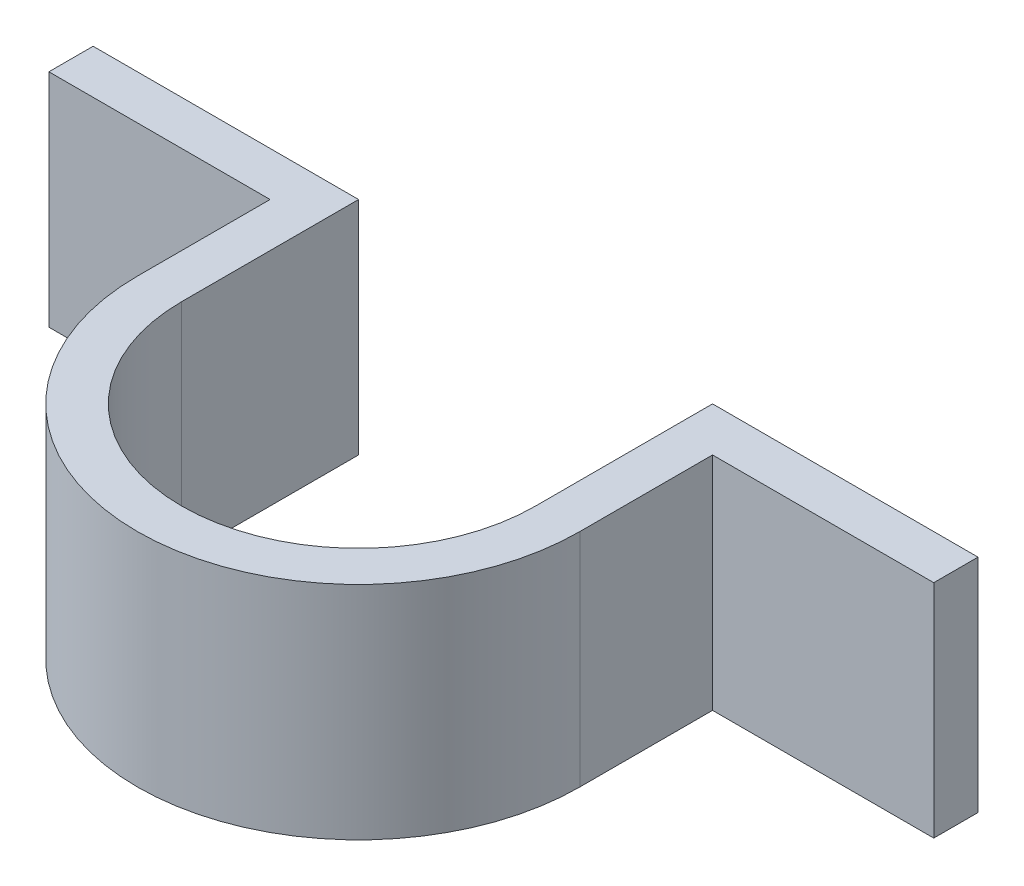
from build123d import *

# Parameters (mm, degrees)
BOSS_EXTRUDE2_DEPTH      = 2.5
BOSS_EXTRUDE2_DEPTH_BACK = 2.5


with BuildPart() as part:
    # Sketch1 → Boss-Extrude2 (new, two sides: drawn at the far end of the back side and taken through both)
    with BuildSketch(Plane(origin=(0, 0, 0), x_dir=(1, 0, 0), z_dir=(0, 1, 0)).offset(-BOSS_EXTRUDE2_DEPTH_BACK)):
        with BuildLine():
            Line((-4, 0), (-4, 4))
            Line((-4, 4), (-10, 4))
            Line((-10, 4), (-10, 3))
            Line((-10, 3), (-5, 3))
            Line((-5, 3), (-5, 0))
            ThreePointArc((-5, 0), (0, -5), (5, 0))
            Line((5, 0), (5, 3))
            Line((5, 3), (10, 3))
            Line((10, 3), (10, 4))
            Line((10, 4), (4, 4))
            Line((4, 4), (4, 0))
            ThreePointArc((4, 0), (0, -4), (-4, 0))
        make_face()
    extrude(amount=BOSS_EXTRUDE2_DEPTH + BOSS_EXTRUDE2_DEPTH_BACK)


solid = part.part
